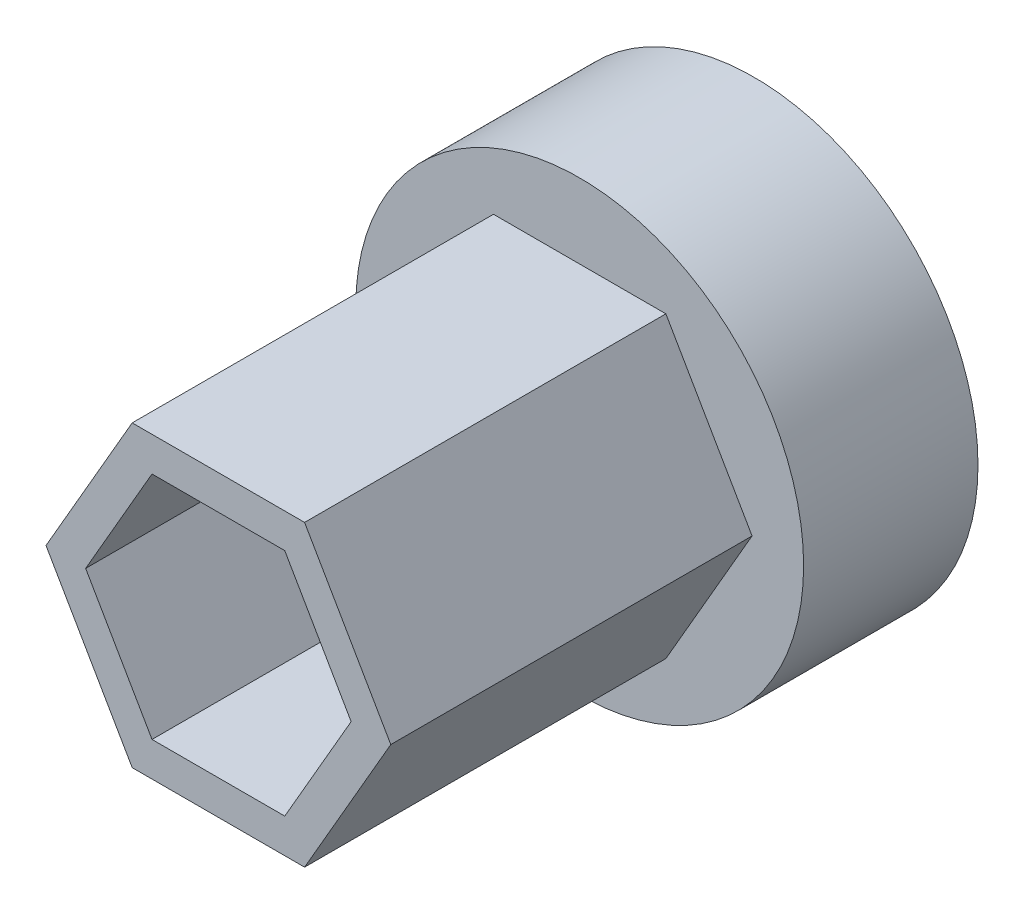
from build123d import *

# Parameters (mm, degrees)
BOSS_EXTRUDE1_DEPTH = 15.367
SKETCH2_R           = 9.525
BOSS_EXTRUDE2_DEPTH = 7.4168


with BuildPart() as part:
    # Sketch1 → Boss-Extrude1 (new body)
    with BuildSketch(Plane.XY):
        Polygon((7.332348419, 0), (3.666174209, 6.35), (-3.666174209, 6.35), (-7.332348419, 0), (-3.666174209, -6.35), (3.666174209, -6.35), align=None)
        Polygon((5.645908282, 0), (2.822954141, 4.8895), (-2.822954141, 4.8895), (-5.645908282, 0), (-2.822954141, -4.8895), (2.822954141, -4.8895), align=None, mode=Mode.SUBTRACT)
    extrude(amount=BOSS_EXTRUDE1_DEPTH)

    # Sketch2 → Boss-Extrude2 (add)
    with BuildSketch(Plane(origin=(0, 0, 0), x_dir=(-1, 0, 0), z_dir=(0, 0, -1))):
        Circle(SKETCH2_R)
        Polygon((5.645908282, 0), (2.822954141, 4.8895), (-2.822954141, 4.8895), (-5.645908282, 0), (-2.822954141, -4.8895), (2.822954141, -4.8895), align=None, mode=Mode.SUBTRACT)
    extrude(amount=BOSS_EXTRUDE2_DEPTH)


solid = part.part
